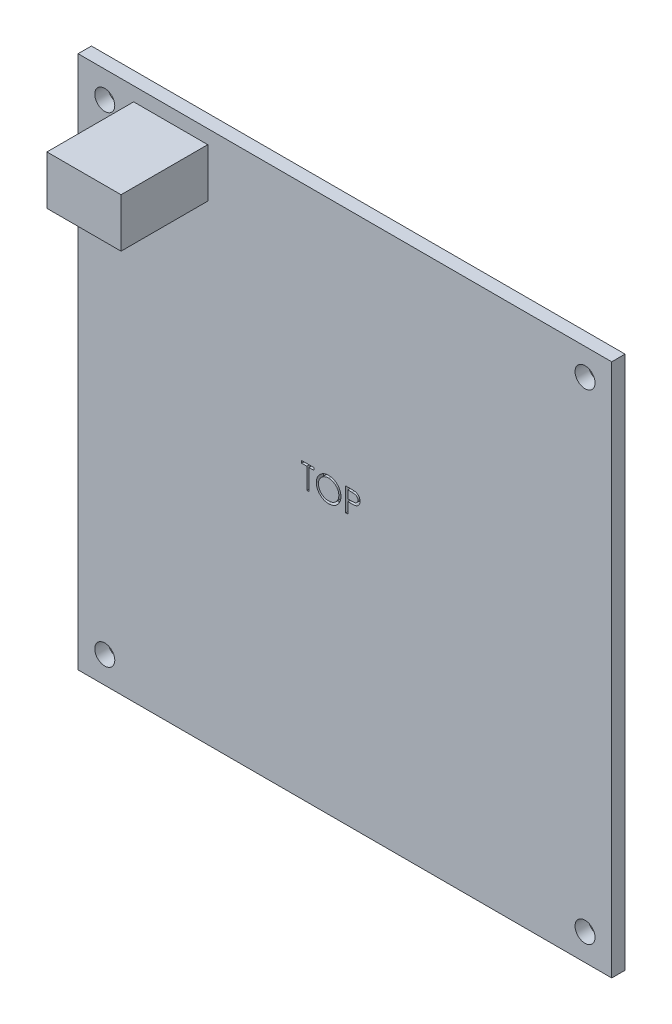
from build123d import *

# Parameters (mm, degrees)
ESQUISSE1_W             = 80
ESQUISSE1_H             = 80
ESQUISSE1_R             = 1.5
BOSS_EXTRU_1_DEPTH      = 2
ENL_V_MAT_EXTRU_1_DEPTH = 1
ESQUISSE4_W             = 11.109598624
ESQUISSE4_H             = 7.332269367
BOSS_EXTRU_2_DEPTH      = 13


with BuildPart() as part:
    # Esquisse1 → Boss.-Extru.1 (new body)
    with BuildSketch(Plane.XY):
        with Locations((40, 40)):
            Rectangle(ESQUISSE1_W, ESQUISSE1_H)
        with Locations((4, 76)):
            Circle(ESQUISSE1_R, mode=Mode.SUBTRACT)
        with Locations(Location((76, 76, 0), (0, 0, 180))):
            Circle(ESQUISSE1_R, mode=Mode.SUBTRACT)
        with Locations((76, 4)):
            Circle(ESQUISSE1_R, mode=Mode.SUBTRACT)
        with Locations(Location((4, 4, 0), (0, 0, 180))):
            Circle(ESQUISSE1_R, mode=Mode.SUBTRACT)
    extrude(amount=BOSS_EXTRU_1_DEPTH)

    # Esquisse2 → Enlèv. mat.-Extru.1 (cut)
    # profile 1 of 3: a face of its own
    with BuildSketch(Plane.XY.offset(2)):
        Polygon((33.52381903, 43.590087066), (33.52381903, 43.949061425), (35.36356262, 43.949061425), (35.36356262, 43.590087066), (34.600742107, 43.590087066), (34.600742107, 40.449061425), (34.286639543, 40.449061425), (34.286639543, 43.590087066), align=None)
    # profile 2 of 3: a face of its own
    with BuildSketch(Plane.XY.offset(2)):
        with BuildLine():
            add(Edge.make_bspline(
                [(37.539844671, 44.038805015), (37.604652777, 44.037163536), (37.731941244, 44.033939535), (37.919016142, 44.009260431), (38.097611237, 43.966565041), (38.269181376, 43.909702059), (38.431674352, 43.833847673), (38.586313245, 43.742162525), (38.732730119, 43.633686066), (38.8689515, 43.509256839), (38.993608451, 43.373873385), (39.103434337, 43.229395475), (39.195476631, 43.076696673), (39.271062418, 42.916235842), (39.330361027, 42.748375874), (39.371280071, 42.572221872), (39.397418221, 42.388915182), (39.400473999, 42.263888317), (39.402024158, 42.200463669)],
                knots=[0, 0, 0, 0, 1.065120563, 2.091984664, 3.0946048, 4.079830382, 5.057816894, 6.036188127, 7.030412546, 8.04752943, 9.064399622, 10.05169764, 11.02544977, 11.989514704, 12.962713494, 13.945757189, 14.957906945, 16, 16, 16, 16], degree=3))
            add(Edge.make_bspline(
                [(39.402024158, 42.200463669), (39.400474226, 42.137506222), (39.397419129, 42.013409802), (39.371250352, 41.831266358), (39.330209352, 41.656175661), (39.271613086, 41.488430009), (39.196387607, 41.327852445), (39.103732436, 41.174865491), (38.994591225, 41.029418993), (38.870384374, 40.893106327), (38.734983332, 40.768108857), (38.589753065, 40.659189981), (38.437959745, 40.565465856), (38.277650037, 40.490682182), (38.11095, 40.430910262), (37.936367677, 40.390157632), (37.754721123, 40.363870589), (37.63085012, 40.360852073), (37.567889543, 40.359317835)],
                knots=[0, 0, 0, 0, 1.043624062, 2.057103931, 3.04512605, 4.022047818, 4.998200453, 5.980619268, 6.982898556, 8.009068085, 9.034988726, 10.034168286, 11.015286542, 11.987931943, 12.962482838, 13.94673481, 14.956375938, 16, 16, 16, 16], degree=3))
            add(Edge.make_bspline(
                [(37.567889543, 40.359317835), (37.504465224, 40.360867222), (37.379439008, 40.363921476), (37.195901973, 40.390102881), (37.019624229, 40.431044185), (36.851109878, 40.489553621), (36.690264948, 40.565170852), (36.536774865, 40.657375231), (36.391255718, 40.766782372), (36.254913972, 40.890948947), (36.130164773, 41.026120499), (36.021405398, 41.170954754), (35.929180284, 41.32261021), (35.853816952, 41.481507734), (35.794152493, 41.646879177), (35.753447674, 41.819827655), (35.727111722, 41.99936716), (35.724076876, 42.121610059), (35.722536979, 42.183636746)],
                knots=[0, 0, 0, 0, 1.053102029, 2.075944431, 3.073151272, 4.055350789, 5.033113405, 6.020478099, 7.024410459, 8.052272461, 9.079885166, 10.07527673, 11.055994387, 12.023226415, 12.992069828, 13.970394897, 14.97016774, 16, 16, 16, 16], degree=3))
            add(Edge.make_bspline(
                [(35.722536979, 42.183636746), (35.723071614, 42.225269415), (35.724134141, 42.308009538), (35.736925833, 42.430876139), (35.755487534, 42.551766796), (35.782089447, 42.670337744), (35.816881114, 42.786298729), (35.857933141, 42.900449492), (35.908072987, 43.011633216), (35.964753635, 43.120376607), (36.028015443, 43.224984513), (36.097891192, 43.323864096), (36.171926561, 43.417845093), (36.253089954, 43.504492097), (36.338706399, 43.586325753), (36.430164778, 43.66208847), (36.526907022, 43.732463421), (36.629349402, 43.795883762), (36.734967677, 43.853242897), (36.843844454, 43.902464748), (36.954501026, 43.944710809), (37.067455674, 43.978951635), (37.182408446, 44.005983671), (37.29961023, 44.024391024), (37.418967657, 44.037215342), (37.499378976, 44.038272844), (37.539844671, 44.038805015)],
                knots=[0, 0, 0, 0, 1.037015668, 2.060948919, 3.074880161, 4.083647147, 5.086022904, 6.090072063, 7.104153813, 8.122640571, 9.144368836, 10.147691507, 11.138137339, 12.123020368, 13.103399296, 14.087645067, 15.080126199, 16.082011238, 17.087798457, 18.072939717, 19.057185487, 20.037253025, 21.01195951, 21.997135196, 22.992090687, 24, 24, 24, 24], degree=3))
        make_face()
        with BuildLine():
            add(Edge.make_bspline(
                [(37.555269351, 43.679830656), (37.522054717, 43.679425766), (37.455942984, 43.678619856), (37.357658448, 43.66800414), (37.260666514, 43.652874251), (37.164947152, 43.631292731), (37.070900863, 43.601888678), (36.977651021, 43.56804777), (36.886047968, 43.526826679), (36.79639411, 43.480253975), (36.709479035, 43.428705054), (36.627466333, 43.371733287), (36.550143689, 43.310674733), (36.477700422, 43.245386895), (36.41034925, 43.175537294), (36.346764549, 43.102184857), (36.289494967, 43.023232966), (36.23700939, 42.940822559), (36.19004155, 42.855060978), (36.148276195, 42.766851116), (36.114112187, 42.675473429), (36.08624981, 42.581919272), (36.063149999, 42.486336812), (36.048516075, 42.388000963), (36.037783716, 42.287405851), (36.03702387, 42.219423997), (36.036639543, 42.185038989)],
                knots=[0, 0, 0, 0, 1.008559885, 2.007477868, 2.99961109, 3.989939068, 4.984837346, 5.991145699, 7.001802488, 8.033829008, 9.059044045, 10.069351652, 11.065060232, 12.050310815, 13.029377138, 14.011219647, 14.996725999, 15.989392538, 16.977580475, 17.965360261, 18.951710183, 19.937753436, 20.929683414, 21.935841486, 22.955955122, 24, 24, 24, 24], degree=3))
            add(Edge.make_bspline(
                [(36.036639543, 42.185038989), (36.037914405, 42.134476769), (36.040422453, 42.035005238), (36.062380023, 41.889237094), (36.096201997, 41.749148808), (36.146059364, 41.615506899), (36.208409978, 41.487162616), (36.285436869, 41.365254511), (36.376695954, 41.249749637), (36.480359481, 41.141454368), (36.593682188, 41.042608564), (36.714014917, 40.955845155), (36.840068525, 40.882434905), (36.972171728, 40.822629833), (37.109619267, 40.775240095), (37.253296818, 40.742761464), (37.402247277, 40.721386008), (37.503777932, 40.719333253), (37.555269351, 40.718292194)],
                knots=[0, 0, 0, 0, 1.032063989, 2.030389145, 3.003944642, 3.970395727, 4.937377036, 5.913328081, 6.909231446, 7.93887556, 8.970685674, 9.976071282, 10.964166581, 11.944589148, 12.933237628, 13.927779006, 14.949070134, 16, 16, 16, 16], degree=3))
            add(Edge.make_bspline(
                [(37.555269351, 40.718292194), (37.589878852, 40.718767699), (37.658519889, 40.719710767), (37.760615411, 40.729209444), (37.860871623, 40.744441313), (37.959147903, 40.766371969), (38.055332714, 40.793819175), (38.149827517, 40.826426903), (38.241625807, 40.867108107), (38.331885645, 40.912056058), (38.418281887, 40.963296216), (38.500757419, 41.018334365), (38.577233399, 41.079302986), (38.64962247, 41.143620799), (38.717250159, 41.212584647), (38.779659144, 41.286104868), (38.836639276, 41.364645526), (38.889104922, 41.446930931), (38.935908185, 41.532927184), (38.976687284, 41.621456862), (39.0112834, 41.712301971), (39.039211905, 41.805593543), (39.061097367, 41.901154392), (39.076177287, 41.99911247), (39.086725725, 42.099271812), (39.087520802, 42.167015668), (39.087921594, 42.201164791)],
                knots=[0, 0, 0, 0, 1.047197238, 2.076906641, 3.100256066, 4.114471768, 5.12198147, 6.126382909, 7.136867548, 8.15857795, 9.17633901, 10.174870724, 11.156907918, 12.133735059, 13.104061851, 14.077631395, 15.04955518, 16.038496417, 17.029181396, 18.010275684, 18.986308667, 19.968651475, 20.955262928, 21.950658345, 22.966943676, 24, 24, 24, 24], degree=3))
            add(Edge.make_bspline(
                [(39.087921594, 42.201164791), (39.087520481, 42.235080295), (39.0867248, 42.302357945), (39.076182325, 42.401818763), (39.061081435, 42.499071975), (39.039318727, 42.593735778), (39.011268573, 42.685834303), (38.976681243, 42.775281051), (38.935895943, 42.862409246), (38.889087719, 42.947003543), (38.836471895, 43.028178281), (38.778977652, 43.105780693), (38.715612304, 43.178353435), (38.648186279, 43.247688129), (38.575015394, 43.312306018), (38.4964311, 43.372228539), (38.413387422, 43.428901813), (38.325460186, 43.480027375), (38.234716233, 43.527241608), (38.141602275, 43.567692611), (38.047173175, 43.60206473), (37.951669063, 43.631381695), (37.854286084, 43.652789725), (37.755682256, 43.668017775), (37.655993997, 43.678616161), (37.588950777, 43.67942454), (37.555269351, 43.679830656)],
                knots=[0, 0, 0, 0, 1.02996197, 2.043119294, 3.035359645, 4.018872909, 4.991431989, 5.957985074, 6.929999688, 7.912076566, 8.892894881, 9.867085534, 10.843653904, 11.817741046, 12.803660682, 13.806313499, 14.818574707, 15.856120519, 16.894564902, 17.924820532, 18.937903209, 19.946497019, 20.957711757, 21.963978472, 22.977135795, 24, 24, 24, 24], degree=3))
        make_face(mode=Mode.SUBTRACT)
    # profile 3 of 3: a face of its own
    with BuildSketch(Plane.XY.offset(2)):
        with BuildLine():
            Line((40.119972876, 43.949061425), (40.806371113, 43.949061425))
            add(Edge.make_bspline(
                [(40.806371113, 43.949061425), (40.85358202, 43.949009529), (40.944040212, 43.948910093), (41.073755268, 43.945895348), (41.191565, 43.941868656), (41.297215381, 43.936286762), (41.391031479, 43.929690172), (41.472588778, 43.920438133), (41.542528335, 43.910777837), (41.584434784, 43.900956431), (41.603546594, 43.896477291)],
                knots=[0, 0, 0, 0, 1.415646017, 2.712440637, 3.8905458, 4.950247383, 5.884950622, 6.709939814, 7.411656543, 8, 8, 8, 8], degree=3))
            add(Edge.make_bspline(
                [(41.603546594, 43.896477291), (41.627740128, 43.889855341), (41.675557105, 43.876767479), (41.744458148, 43.850553756), (41.810011994, 43.81947159), (41.872443552, 43.784047651), (41.930985635, 43.742762086), (41.986511676, 43.697288469), (42.038531657, 43.6465769), (42.086753048, 43.59119616), (42.131037846, 43.53207595), (42.169167529, 43.46833372), (42.201094756, 43.401042417), (42.228478027, 43.330248846), (42.248186482, 43.255358522), (42.263033381, 43.17689181), (42.272457009, 43.09485712), (42.273359571, 43.038797252), (42.27381903, 43.010259342)],
                knots=[0, 0, 0, 0, 0.999701418, 1.975846123, 2.934577507, 3.890451536, 4.834027766, 5.787354733, 6.749476667, 7.726910423, 8.712836071, 9.690891519, 10.682875813, 11.679750201, 12.712814741, 13.765529915, 14.8625177, 16, 16, 16, 16], degree=3))
            add(Edge.make_bspline(
                [(42.27381903, 43.010259342), (42.273397605, 42.981481565), (42.272573059, 42.925175901), (42.262676774, 42.842803113), (42.249346583, 42.764084723), (42.22884953, 42.689195272), (42.202003857, 42.618579502), (42.170511804, 42.55115827), (42.132528274, 42.488078598), (42.088883444, 42.42911148), (42.04033185, 42.374201568), (41.987078912, 42.323746774), (41.929339619, 42.278042435), (41.867297471, 42.236986092), (41.800347622, 42.201529812), (41.729505469, 42.169772507), (41.654155252, 42.143101446), (41.602012738, 42.129071385), (41.575501722, 42.121938028)],
                knots=[0, 0, 0, 0, 1.121902311, 2.195077645, 3.232258892, 4.234102512, 5.217864754, 6.176164875, 7.132989551, 8.084763148, 9.034132444, 9.988522005, 10.94243251, 11.903244335, 12.886203696, 13.894208494, 14.929344452, 16, 16, 16, 16], degree=3))
            add(Edge.make_bspline(
                [(41.575501722, 42.121938028), (41.553574388, 42.117275047), (41.505519361, 42.107055853), (41.426376639, 42.095647396), (41.334231253, 42.085909795), (41.229208973, 42.078608657), (41.111404068, 42.072358289), (40.980752811, 42.067390195), (40.836998734, 42.064660341), (40.73672749, 42.064519548), (40.684375921, 42.064446041)],
                knots=[0, 0, 0, 0, 0.601384939, 1.31797006, 2.144135048, 3.087295005, 4.142315834, 5.309527816, 6.595305764, 8, 8, 8, 8], degree=3))
            Line((40.684375921, 42.064446041), (40.43407544, 42.064446041))
            Line((40.43407544, 42.064446041), (40.43407544, 40.449061425))
            Line((40.43407544, 40.449061425), (40.119972876, 40.449061425))
            Line((40.119972876, 40.449061425), (40.119972876, 43.949061425))
        make_face()
        with BuildLine():
            Line((40.43407544, 43.590087066), (40.43407544, 42.4234204))
            Line((40.43407544, 42.4234204), (41.046855889, 42.41570806))
            add(Edge.make_bspline(
                [(41.046855889, 42.41570806), (41.076775815, 42.415692596), (41.134535615, 42.415662744), (41.217971838, 42.419647968), (41.295381125, 42.4242485), (41.366525701, 42.430984424), (41.431437635, 42.440505681), (41.490225164, 42.450117419), (41.542432447, 42.464022782), (41.603531649, 42.482745851), (41.671614996, 42.514678466), (41.745682545, 42.561028357), (41.808453131, 42.620109065), (41.862771428, 42.686536896), (41.905877306, 42.760436026), (41.937433298, 42.839504962), (41.955974456, 42.922932812), (41.958460649, 42.980020951), (41.959716466, 43.008857098)],
                knots=[0, 0, 0, 0, 1.160613943, 2.240541288, 3.23993089, 4.169200891, 5.011653406, 5.7853311, 6.478053781, 7.106038997, 8.262395093, 9.384106736, 10.481365981, 11.59014053, 12.70357646, 13.786202915, 14.881775077, 16, 16, 16, 16], degree=3))
            add(Edge.make_bspline(
                [(41.959716466, 43.008857098), (41.95845382, 43.036995612), (41.955943835, 43.092931494), (41.937287971, 43.174910254), (41.905938658, 43.253145959), (41.862482063, 43.326119044), (41.809740933, 43.392307848), (41.74844159, 43.449804975), (41.678728329, 43.496026678), (41.613880098, 43.52585996), (41.556278912, 43.544075235), (41.506246952, 43.556820076), (41.449756277, 43.566995682), (41.386788498, 43.575235185), (41.317831664, 43.582288646), (41.242293349, 43.587074623), (41.160459706, 43.589876079), (41.103649135, 43.590015035), (41.074199639, 43.590087066)],
                knots=[0, 0, 0, 0, 1.120700087, 2.227813068, 3.331159281, 4.466773991, 5.599788987, 6.693661531, 7.80175334, 8.91857717, 9.525282508, 10.207424825, 10.974604443, 11.810962634, 12.737642355, 13.736264703, 14.826523623, 16, 16, 16, 16], degree=3))
            Line((41.074199639, 43.590087066), (40.43407544, 43.590087066))
        make_face(mode=Mode.SUBTRACT)
    extrude(amount=-ENL_V_MAT_EXTRU_1_DEPTH, mode=Mode.SUBTRACT)

    # Esquisse4 → Boss.-Extru.2 (add)
    with BuildSketch(Plane.XY.offset(2)):
        with Locations((13.885304007, 74.247390851)):
            Rectangle(ESQUISSE4_W, ESQUISSE4_H)
    extrude(amount=BOSS_EXTRU_2_DEPTH)


solid = part.part
